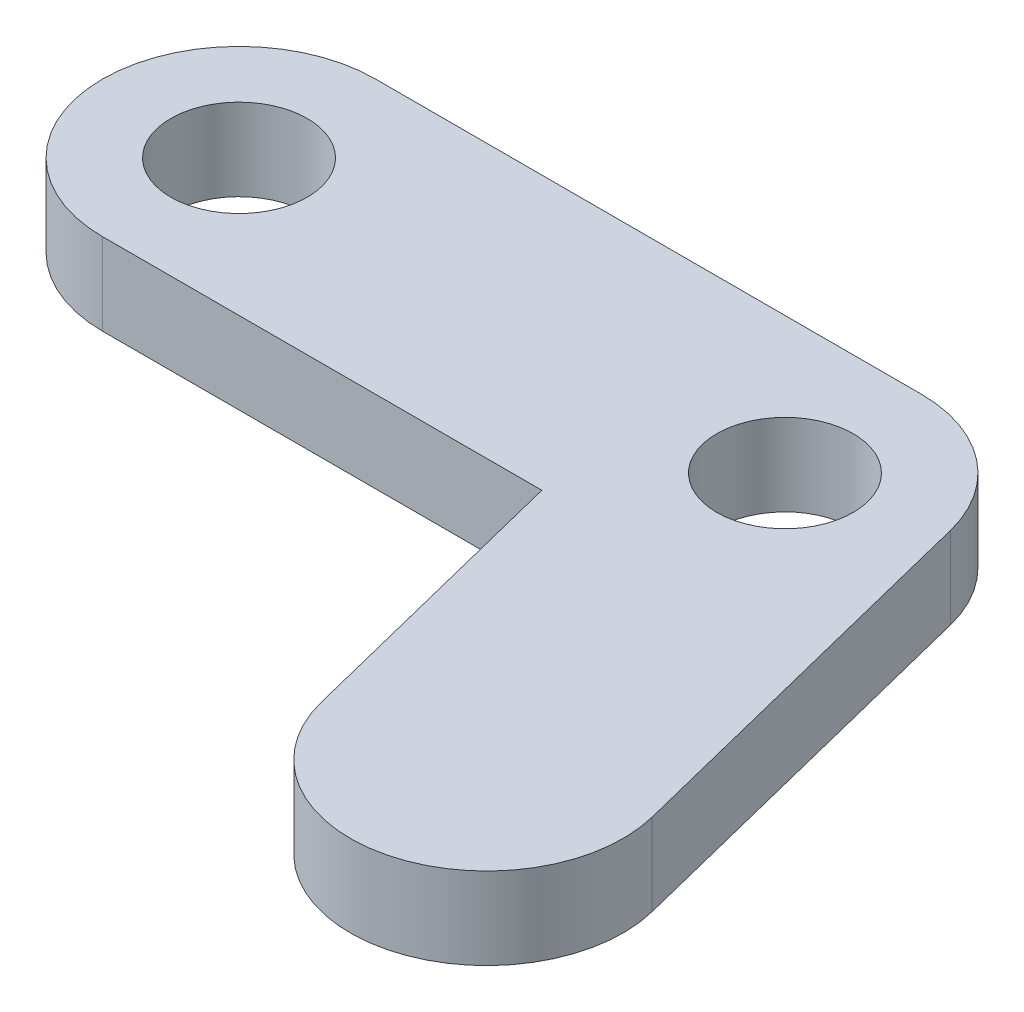
from build123d import *

# Parameters (mm, degrees)
SKETCH1_R           = 2.5
BOSS_EXTRUDE1_DEPTH = 3


with BuildPart() as part:
    # Sketch1 → Boss-Extrude1 (new body)
    # profile 1 of 3: a face of its own
    with BuildSketch(Plane(origin=(0, 0, 0), x_dir=(1, 0, 0), z_dir=(0, 1, 0))):
        with BuildLine():
            Line((20, 5), (0, 5))
            ThreePointArc((0, 5), (-5, 0), (0, -5))
            Line((0, -5), (16.093571867, -5))
            Line((16.093571867, -5), (15.148521369, -1.209609478))
            ThreePointArc((15.148521369, -1.209609478), (16.059946232, 3.078307377), (20, 5))
        make_face()
        with Locations(Location((0, 0, 0), (0, 0, 270))):
            Circle(SKETCH1_R, mode=Mode.SUBTRACT)
    # profile 2 of 3: a face of its own
    with BuildSketch(Plane(origin=(0, 0, 0), x_dir=(1, 0, 0), z_dir=(0, 1, 0))):
        with BuildLine():
            ThreePointArc((24.851478631, 1.209609478), (23.078307377, 3.940053768), (20, 5))
            ThreePointArc((20, 5), (16.059946232, 3.078307377), (15.148521369, -1.209609478))
            Line((15.148521369, -1.209609478), (16.093571867, -5))
            Line((16.093571867, -5), (20, -5))
            ThreePointArc((20, -5), (23.940053768, -3.078307377), (24.851478631, 1.209609478))
        make_face()
        with Locations(Location((20, 0, 0), (0, 0, 270))):
            Circle(SKETCH1_R, mode=Mode.SUBTRACT)
    # profile 3 of 3: a face of its own
    with BuildSketch(Plane(origin=(0, 0, 0), x_dir=(1, 0, 0), z_dir=(0, 1, 0))):
        with BuildLine():
            Line((28.480307065, -13.344826416), (24.851478631, 1.209609478))
            ThreePointArc((24.851478631, 1.209609478), (23.940053768, -3.078307377), (20, -5))
            Line((20, -5), (16.093571867, -5))
            Line((16.093571867, -5), (18.777349803, -15.764045372))
            ThreePointArc((18.777349803, -15.764045372), (24.838437912, -19.405914526), (28.480307065, -13.344826416))
        make_face()
    extrude(amount=BOSS_EXTRUDE1_DEPTH)


solid = part.part
